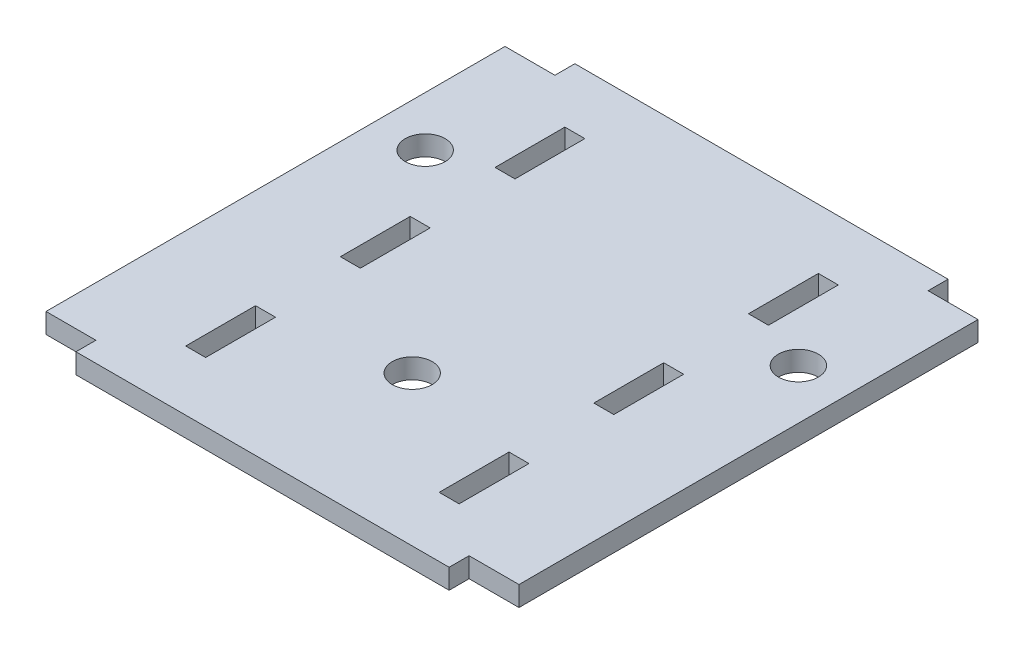
from build123d import *

# Parameters (mm, degrees)
SKETCH1_W           = 2
SKETCH1_H           = 7
SKETCH1_R           = 2
BOSS_EXTRUDE1_DEPTH = 2
SKETCH2_W           = 27.8
SKETCH2_H           = 50
CUT_EXTRUDE1_DEPTH  = 10


with BuildPart() as part:
    # Sketch1 → Boss-Extrude1 (new body)
    with BuildSketch(Plane(origin=(0, 0, 0), x_dir=(1, 0, 0), z_dir=(0, 1, 0))):
        Polygon((-42.999453113, 2.019339096), (-70.799453113, 2.019339096), (-70.799453113, -47.980660904), (-42.999453113, -47.980660904), (-42.999453113, -45.980660904), (-37.999453113, -45.980660904), (-37.999453113, -47.980660904), (-0.599453113, -47.980660904), (-0.599453113, -45.980660904), (4.400546887, -45.980660904), (4.400546887, -47.980660904), (32.200546887, -47.980660904), (32.200546887, 2.019339096), (4.400546887, 2.019339096), (4.400546887, 0.019339096), (-0.599453113, 0.019339096), (-0.599453113, 2.019339096), (-37.999453113, 2.019339096), (-37.999453113, 0.019339096), (-42.999453113, 0.019339096), align=None)
        with Locations((-31.999453113, -38.480660904)):
            Rectangle(SKETCH1_W, SKETCH1_H, mode=Mode.SUBTRACT)
        with Locations((-6.599453113, -38.480660904)):
            Rectangle(SKETCH1_W, SKETCH1_H, mode=Mode.SUBTRACT)
        with Locations(Location((-19.299453113, -32.980660904, 0), (0, 0, 270))):
            Circle(SKETCH1_R, mode=Mode.SUBTRACT)
        with Locations((-31.999453113, -22.980660904)):
            Rectangle(SKETCH1_W, SKETCH1_H, mode=Mode.SUBTRACT)
        with Locations(Location((-37.999453113, -12.980660904, 0), (0, 0, 270))):
            Circle(SKETCH1_R, mode=Mode.SUBTRACT)
        with Locations((-31.999453113, -7.480660904)):
            Rectangle(SKETCH1_W, SKETCH1_H, mode=Mode.SUBTRACT)
        with Locations((-6.599453113, -22.980660904)):
            Rectangle(SKETCH1_W, SKETCH1_H, mode=Mode.SUBTRACT)
        with Locations(Location((-0.599453113, -12.980660904, 0), (0, 0, 270))):
            Circle(SKETCH1_R, mode=Mode.SUBTRACT)
        with Locations((-6.599453113, -7.480660904)):
            Rectangle(SKETCH1_W, SKETCH1_H, mode=Mode.SUBTRACT)
    extrude(amount=BOSS_EXTRUDE1_DEPTH)

    # Sketch2 → Cut-Extrude1 (cut)
    with BuildSketch(Plane(origin=(0, 0, 0), x_dir=(-1, 0, 0), z_dir=(0, -1, 0))):
        with Locations((56.899453113, -22.980660904)):
            Rectangle(SKETCH2_W, SKETCH2_H)
        with Locations((-18.300546887, -22.980660904)):
            Rectangle(SKETCH2_W, SKETCH2_H)
    extrude(amount=-CUT_EXTRUDE1_DEPTH, mode=Mode.SUBTRACT)


solid = part.part
